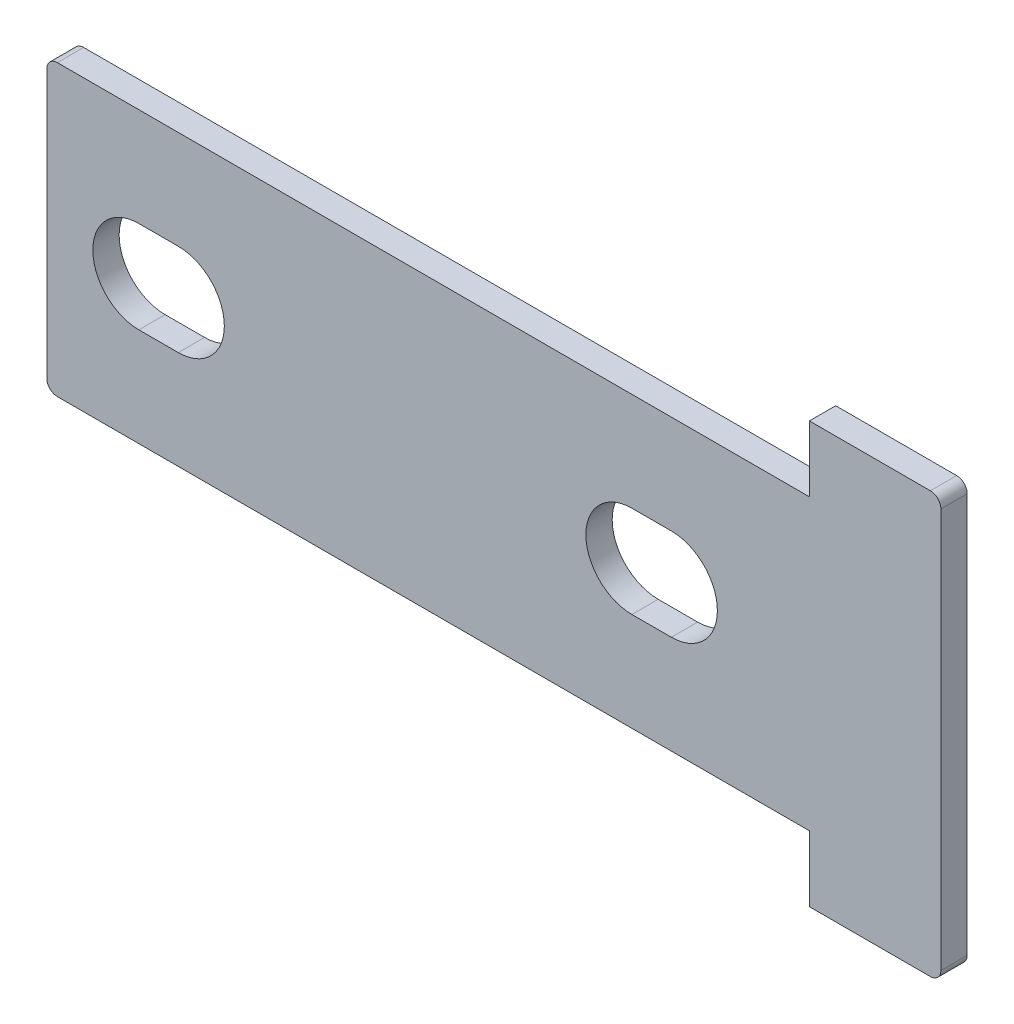
from build123d import *

# Parameters (mm, degrees)
DODANIE_WYCI_GNI_CIE1_DEPTH = 1


with BuildPart() as part:
    # Szkic1 → Dodanie-wyciągnięcie1 (new body)
    with BuildSketch(Plane.XY):
        with BuildLine():
            Line((-3.1, -1.267343807), (25.5, -1.267343807))
            Line((25.5, -1.267343807), (25.5, -3.767343807))
            Line((25.5, -3.767343807), (30.1, -3.767343807))
            ThreePointArc((30.1, -3.767343807), (30.382842712, -3.650186519), (30.5, -3.367343807))
            Line((30.5, -3.367343807), (30.5, 11.832656193))
            ThreePointArc((30.5, 11.832656193), (30.382842712, 12.115498905), (30.1, 12.232656193))
            Line((30.1, 12.232656193), (25.5, 12.232656193))
            Line((25.5, 12.232656193), (25.5, 9.732656193))
            Line((25.5, 9.732656193), (-3.1, 9.732656193))
            ThreePointArc((-3.1, 9.732656193), (-3.382842712, 9.615498905), (-3.5, 9.332656193))
            Line((-3.5, 9.332656193), (-3.5, -0.867343807))
            ThreePointArc((-3.5, -0.867343807), (-3.382842712, -1.150186519), (-3.1, -1.267343807))
        make_face()
        with BuildLine():
            Line((18.75, 5.982656193), (20.25, 5.982656193))
            ThreePointArc((20.25, 5.982656193), (22, 4.232656193), (20.25, 2.482656193))
            Line((20.25, 2.482656193), (18.75, 2.482656193))
            ThreePointArc((18.75, 2.482656193), (17, 4.232656193), (18.75, 5.982656193))
        make_face(mode=Mode.SUBTRACT)
        with BuildLine():
            Line((0, 5.982656193), (1.5, 5.982656193))
            ThreePointArc((1.5, 5.982656193), (3.25, 4.232656193), (1.5, 2.482656193))
            Line((1.5, 2.482656193), (0, 2.482656193))
            ThreePointArc((0, 2.482656193), (-1.75, 4.232656193), (0, 5.982656193))
        make_face(mode=Mode.SUBTRACT)
    extrude(amount=DODANIE_WYCI_GNI_CIE1_DEPTH)


solid = part.part
